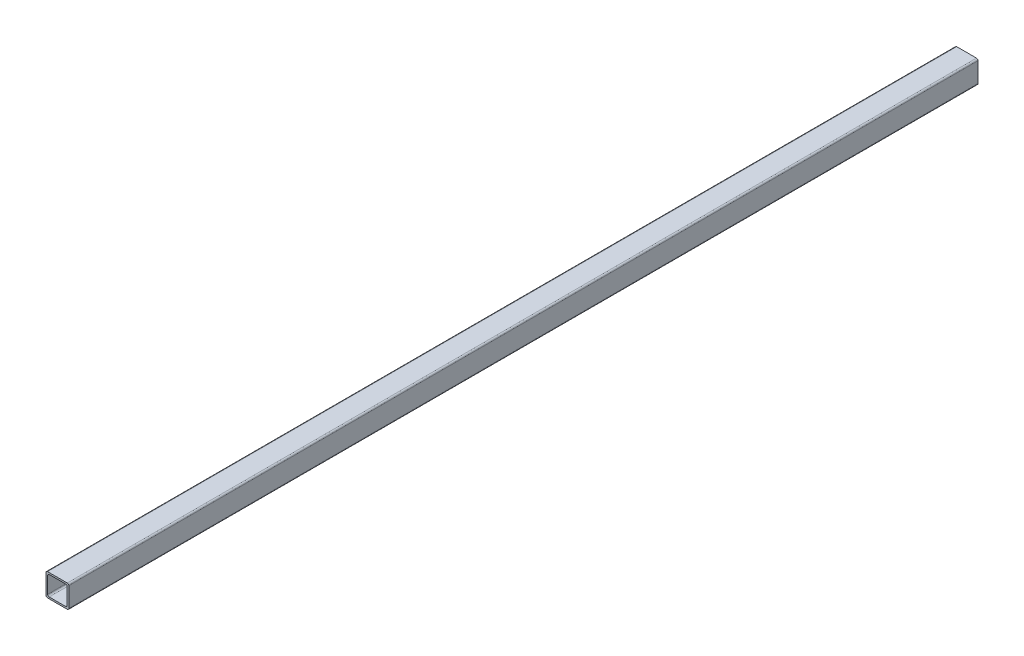
from build123d import *

# Parameters (mm, degrees)
BOSS_EXTRUDE1_DEPTH = 1520


with BuildPart() as part:
    # Sketch1 → Boss-Extrude1 (new body)
    with BuildSketch(Plane.XY):
        with BuildLine():
            Line((2.54, 0), (35.56, 0))
            ThreePointArc((35.56, 0), (37.356051224, -0.743948776), (38.1, -2.54))
            Line((38.1, -2.54), (38.1, -35.56))
            ThreePointArc((38.1, -35.56), (37.356051224, -37.356051224), (35.56, -38.1))
            Line((35.56, -38.1), (2.54, -38.1))
            ThreePointArc((2.54, -38.1), (0.743948776, -37.356051224), (0, -35.56))
            Line((0, -35.56), (0, -2.54))
            ThreePointArc((0, -2.54), (0.743948776, -0.743948776), (2.54, 0))
        make_face()
        with BuildLine():
            Line((5.3086, -2.7686), (32.7914, -2.7686))
            ThreePointArc((32.7914, -2.7686), (34.587451224, -3.512548776), (35.3314, -5.3086))
            Line((35.3314, -5.3086), (35.3314, -32.7914))
            ThreePointArc((35.3314, -32.7914), (34.587451224, -34.587451224), (32.7914, -35.3314))
            Line((32.7914, -35.3314), (5.3086, -35.3314))
            ThreePointArc((5.3086, -35.3314), (3.512548776, -34.587451224), (2.7686, -32.7914))
            Line((2.7686, -32.7914), (2.7686, -5.3086))
            ThreePointArc((2.7686, -5.3086), (3.512548776, -3.512548776), (5.3086, -2.7686))
        make_face(mode=Mode.SUBTRACT)
    extrude(amount=BOSS_EXTRUDE1_DEPTH)


solid = part.part
